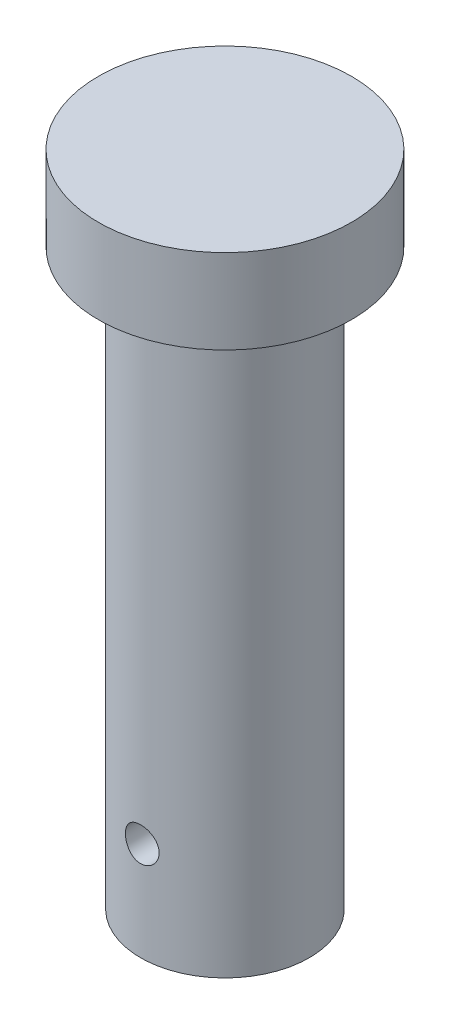
from build123d import *

# Parameters (mm, degrees)
CUT_EXTRUDE1_DEPTH      = 122.249742268
CUT_EXTRUDE1_DEPTH_BACK = 122.249742268
SKETCH2_R               = 3


with BuildPart() as part:
    # Sketch1 → Revolve1 (revolve)
    with BuildSketch(Plane.XY, mode=Mode.PRIVATE) as revolve1_sk:
        Polygon((0, 0), (0, 117), (22.5, 117), (22.5, 102), (15, 102), (15, 0), align=None)
    revolve(revolve1_sk.sketch.rotate(Axis((0, 0, 0), (0, 1, 0)), 90), axis=Axis((0, 0, 0), (0, 1, 0)))

    # Sketch2 → Cut-Extrude1 (cut, two sides: drawn at the far end of the back side and taken through both)
    with BuildSketch(Plane.XY.offset(-CUT_EXTRUDE1_DEPTH_BACK)):
        with Locations((0, 17.5)):
            Circle(SKETCH2_R)
    extrude(amount=CUT_EXTRUDE1_DEPTH + CUT_EXTRUDE1_DEPTH_BACK, mode=Mode.SUBTRACT)


solid = part.part
